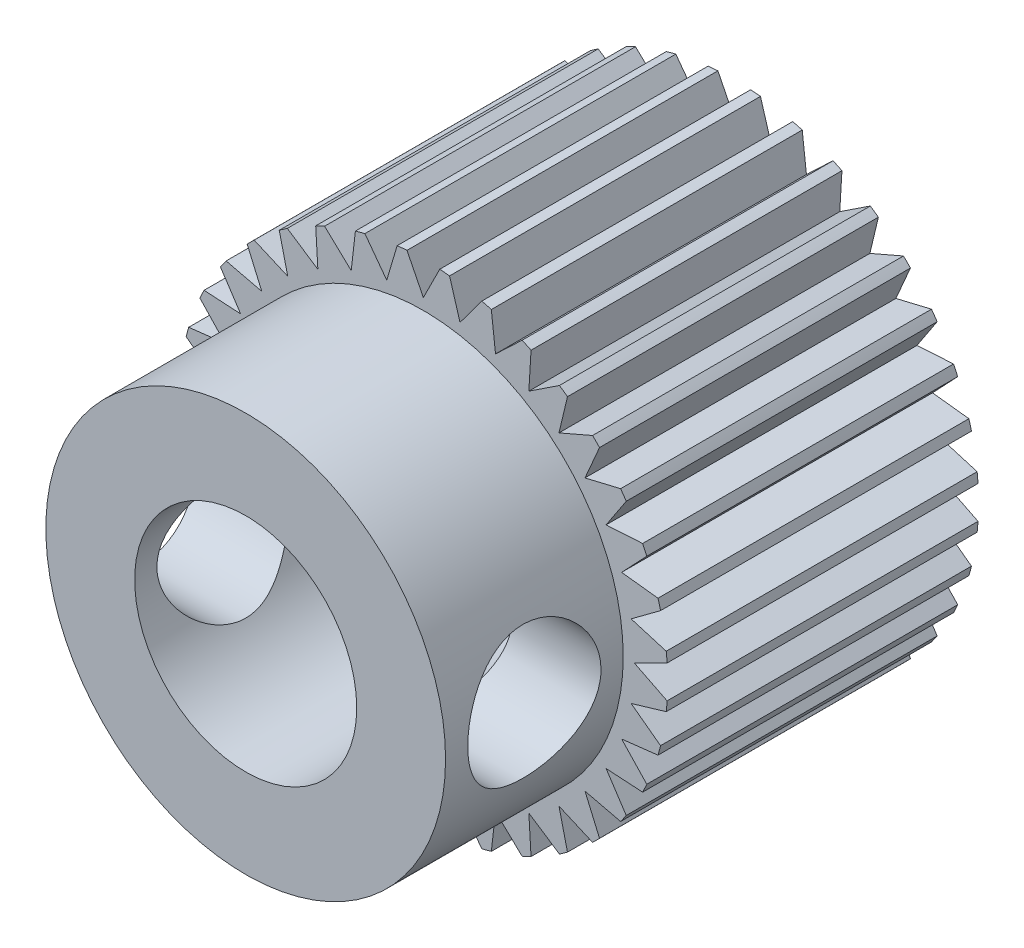
from build123d import *

# Parameters (mm, degrees)
SKETCH1_R               = 5.5
BOSS_EXTRUDE1_DEPTH     = 7
CUT_EXTRUDE3_DEPTH      = 7
SKETCH3_R               = 4.5
BOSS_EXTRUDE2_DEPTH     = 4
CUT_EXTRUDE4_DEPTH      = 6
CUT_EXTRUDE4_DEPTH_BACK = 6
SKETCH4_R               = 1.5
SKETCH5_R               = 2.5
CUT_EXTRUDE5_DEPTH      = 12


with BuildPart() as part:
    # Sketch1 → Boss-Extrude1 (new body)
    with BuildSketch(Plane.XY):
        Circle(SKETCH1_R)
    extrude(amount=BOSS_EXTRUDE1_DEPTH)

    # Sketch2 → Cut-Extrude3 (cut)
    with BuildSketch(Plane.XY.offset(7)):
        Polygon((0, 4.75), (-0.5, 5.75), (0.5, 5.75), align=None)
        Polygon((0.824828844, 4.677836827), (0.506073145, 5.749468669), (1.490880898, 5.575820491), align=None)
        Polygon((1.624595681, 4.463539949), (1.496769514, 5.574242641), (2.436462135, 5.232222498), align=None)
        Polygon((2.375, 4.113620668), (2.441987298, 5.229646072), (3.308012702, 4.729646072), align=None)
        Polygon((3.053241146, 3.638711105), (3.313006534, 4.726149353), (4.079050977, 4.083361743), align=None)
        Polygon((3.638711105, 3.053241146), (4.083361743, 4.079050977), (4.726149353, 3.313006534), align=None)
        Polygon((4.113620668, 2.375), (4.729646072, 3.308012702), (5.229646072, 2.441987298), align=None)
        Polygon((4.463539949, 1.624595681), (5.232222498, 2.436462135), (5.574242641, 1.496769514), align=None)
        Polygon((4.677836827, 0.824828844), (5.575820491, 1.490880898), (5.749468669, 0.506073145), align=None)
        Polygon((4.75, 0), (5.75, 0.5), (5.75, -0.5), align=None)
        Polygon((4.677836827, -0.824828844), (5.749468669, -0.506073145), (5.575820491, -1.490880898), align=None)
        Polygon((4.463539949, -1.624595681), (5.574242641, -1.496769514), (5.232222498, -2.436462135), align=None)
        Polygon((4.113620668, -2.375), (5.229646072, -2.441987298), (4.729646072, -3.308012702), align=None)
        Polygon((3.638711105, -3.053241146), (4.726149353, -3.313006534), (4.083361743, -4.079050977), align=None)
        Polygon((3.053241146, -3.638711105), (4.079050977, -4.083361743), (3.313006534, -4.726149353), align=None)
        Polygon((2.375, -4.113620668), (3.308012702, -4.729646072), (2.441987298, -5.229646072), align=None)
        Polygon((1.624595681, -4.463539949), (2.436462135, -5.232222498), (1.496769514, -5.574242641), align=None)
        Polygon((0.824828844, -4.677836827), (1.490880898, -5.575820491), (0.506073145, -5.749468669), align=None)
        Polygon((0, -4.75), (0.5, -5.75), (-0.5, -5.75), align=None)
        Polygon((-0.824828844, -4.677836827), (-0.506073145, -5.749468669), (-1.490880898, -5.575820491), align=None)
        Polygon((-1.624595681, -4.463539949), (-1.496769514, -5.574242641), (-2.436462135, -5.232222498), align=None)
        Polygon((-2.375, -4.113620668), (-2.441987298, -5.229646072), (-3.308012702, -4.729646072), align=None)
        Polygon((-3.053241146, -3.638711105), (-3.313006534, -4.726149353), (-4.079050977, -4.083361743), align=None)
        Polygon((-3.638711105, -3.053241146), (-4.083361743, -4.079050977), (-4.726149353, -3.313006534), align=None)
        Polygon((-4.113620668, -2.375), (-4.729646072, -3.308012702), (-5.229646072, -2.441987298), align=None)
        Polygon((-4.463539949, -1.624595681), (-5.232222498, -2.436462135), (-5.574242641, -1.496769514), align=None)
        Polygon((-4.677836827, -0.824828844), (-5.575820491, -1.490880898), (-5.749468669, -0.506073145), align=None)
        Polygon((-4.75, 0), (-5.75, -0.5), (-5.75, 0.5), align=None)
        Polygon((-4.677836827, 0.824828844), (-5.749468669, 0.506073145), (-5.575820491, 1.490880898), align=None)
        Polygon((-4.463539949, 1.624595681), (-5.574242641, 1.496769514), (-5.232222498, 2.436462135), align=None)
        Polygon((-4.113620668, 2.375), (-5.229646072, 2.441987298), (-4.729646072, 3.308012702), align=None)
        Polygon((-3.638711105, 3.053241146), (-4.726149353, 3.313006534), (-4.083361743, 4.079050977), align=None)
        Polygon((-3.053241146, 3.638711105), (-4.079050977, 4.083361743), (-3.313006534, 4.726149353), align=None)
        Polygon((-2.375, 4.113620668), (-3.308012702, 4.729646072), (-2.441987298, 5.229646072), align=None)
        Polygon((-1.624595681, 4.463539949), (-2.436462135, 5.232222498), (-1.496769514, 5.574242641), align=None)
        Polygon((-0.824828844, 4.677836827), (-1.490880898, 5.575820491), (-0.506073145, 5.749468669), align=None)
    extrude(amount=-CUT_EXTRUDE3_DEPTH, mode=Mode.SUBTRACT)

    # Sketch3 → Boss-Extrude2 (add)
    with BuildSketch(Plane.XY.offset(7)):
        Circle(SKETCH3_R)
    extrude(amount=BOSS_EXTRUDE2_DEPTH)

    # Sketch4 → Cut-Extrude4 (cut, two sides: drawn at the far end of the back side and taken through both)
    with BuildSketch(Plane(origin=(0, 0, 0), x_dir=(0, 0, -1), z_dir=(1, 0, 0)).offset(-CUT_EXTRUDE4_DEPTH_BACK)):
        with Locations((-9, 0)):
            Circle(SKETCH4_R)
    extrude(amount=CUT_EXTRUDE4_DEPTH + CUT_EXTRUDE4_DEPTH_BACK, mode=Mode.SUBTRACT)

    # Sketch5 → Cut-Extrude5 (cut)
    with BuildSketch(Plane.XY.offset(11)):
        Circle(SKETCH5_R)
    extrude(amount=-CUT_EXTRUDE5_DEPTH, mode=Mode.SUBTRACT)


solid = part.part
